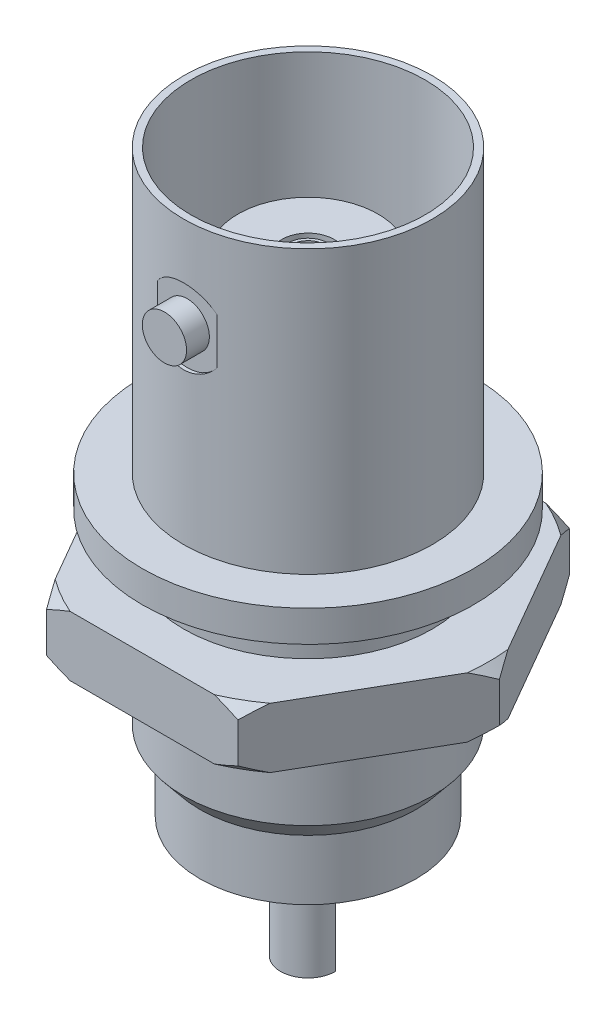
from build123d import *
from build123d.topology import SkipClean

# Parameters (mm, degrees)
BOSS_EXTRUDE1_START = 3.9
SKETCH2_R           = 4.7625
BOSS_EXTRUDE1_DEPTH = 2.3
BOSS_EXTRUDE2_START = 4.5
SKETCH5_R           = 0.846945363
BOSS_EXTRUDE2_DEPTH = 1
SKETCH6_R           = 0.645187132
CUT_EXTRUDE1_DEPTH  = 5
SKETCH9_W           = 0.137399245
SKETCH9_H           = 0.594121804
BOSS_EXTRUDE3_START = 3
BOSS_EXTRUDE3_DEPTH = 3
SKETCH11_R          = 0.94402027
CUT_EXTRUDE2_DEPTH  = 3
SKETCH13_R          = 0.99938664
SKETCH13_R_2        = 0.759397748
CUT_EXTRUDE4_DEPTH  = 4


with BuildPart() as part:
    # Sketch1 → Revolve1 (revolve)
    with BuildSketch(Plane.XY, mode=Mode.PRIVATE) as revolve1_sk:
        Polygon((0, 7.249356935), (-2.68096621, 7.249356935), (-2.68096621, 0), (-4.484856827, 0), (-4.484856827, 10.8), (-4.7625, 10.8), (-4.7625, 0), (-6.35, 0), (-6.35, -1.2), (-4.7625, -1.2), (-4.7625, -8.33684753), (-4.138651138, -9.1), (-4.138651138, -11.4), (-1.05, -11.4), (-1.05, -13.015612484), (0, -13.015612484), align=None)
    revolve(revolve1_sk.sketch.rotate(Axis((0, 72.402332312, 0), (0, -1, 0)), 270), axis=Axis((0, 72.402332312, 0), (0, -1, 0)))

    # Sketch2 → Boss-Extrude1 (add)
    with BuildSketch(Plane.XZ.offset(1.2).offset(BOSS_EXTRUDE1_START)):
        Polygon((3.666174209, -6.35), (7.332348419, 0), (3.666174209, 6.35), (-3.666174209, 6.35), (-7.332348419, 0), (-3.666174209, -6.35), align=None)
        with Locations(Location((0, 0, 0), (0, 0, 90))):
            Circle(SKETCH2_R, mode=Mode.SUBTRACT)
    extrude(amount=-BOSS_EXTRUDE1_DEPTH)

    # Sketch4 → Cut-Revolve1 (revolve, cut)
    with BuildSketch(Plane.XY):
        Polygon((-6.925646916, -2.8), (-7.332348419, -3.186501065), (-8.999279983, -3.186501065), (-8.361056601, -0.327260314), (-6.925646916, 0.349979738), align=None)
        Polygon((-6.925646916, -8.249979738), (-6.925646916, -5.1), (-7.332348419, -4.713498935), (-8.999279983, -4.713498935), (-8.361056601, -7.572739686), align=None)
    revolve(axis=Axis((0, 10.8, 0), (0, -1, 0)), mode=Mode.SUBTRACT)

    # Sketch5 → Boss-Extrude2 (add)
    with BuildSketch(Plane.XY.offset(BOSS_EXTRUDE2_START)):
        with Locations(Location((0, 7.245112304, 0), (0, 0, 270))):
            Circle(SKETCH5_R)
    boss_extrude2 = extrude(amount=BOSS_EXTRUDE2_DEPTH)

    # Mirror1: Boss-Extrude2 across plane
    add(boss_extrude2.mirror(Plane.XY))

    # Sketch6 → Cut-Extrude1 (cut)
    with BuildSketch(Plane(origin=(0, 7.249356935, 0), x_dir=(1, 0, 0), z_dir=(0, 1, 0))):
        with Locations(Location((0, 0, 0), (0, 0, 270))):
            Circle(SKETCH6_R)
    extrude(amount=-CUT_EXTRUDE1_DEPTH, mode=Mode.SUBTRACT)

    # Sketch9 → Cut-Revolve2 (revolve, cut)
    with SkipClean():  # the faces are left unmerged after this step: merging them gives an invalid solid
        with BuildSketch(Plane(origin=(0, 0, 0), x_dir=(0, 0, -1), z_dir=(1, 0, 0)), mode=Mode.PRIVATE) as cut_revolve2_sk:
            with Locations((4.693800378, 8.389118569)):
                Rectangle(SKETCH9_W, SKETCH9_H)
            with Locations((-4.693800378, 8.389118569)):
                Rectangle(SKETCH9_W, SKETCH9_H)
        revolve(cut_revolve2_sk.sketch.rotate(Axis((0, 7.245112304, 5.5), (0, 0, -1)), 90), axis=Axis((0, 7.245112304, 5.5), (0, 0, -1)), mode=Mode.SUBTRACT)

    # Sketch10 → Boss-Extrude3 (add)
    with SkipClean():  # the faces are left unmerged after this step: merging them gives an invalid solid
        with BuildSketch(Plane.XZ.offset(13.015612484).offset(BOSS_EXTRUDE3_START)):
            with BuildLine():
                Line((0.94402027, 0), (1.05, 0))
                ThreePointArc((1.05, 0), (0, 1.05), (-1.05, 0))
                Line((-1.05, 0), (-0.94402027, 0))
                ThreePointArc((-0.94402027, 0), (0, 0.94402027), (0.94402027, 0))
            make_face()
        extrude(amount=-BOSS_EXTRUDE3_DEPTH)

    # Sketch11 → Cut-Extrude2 (cut)
    with SkipClean():  # the faces are left unmerged after this step: merging them gives an invalid solid
        with BuildSketch(Plane.XZ.offset(13.015612484)):
            Circle(SKETCH11_R)
        extrude(amount=-CUT_EXTRUDE2_DEPTH, mode=Mode.SUBTRACT)

    # Sketch13 → Cut-Extrude4 (cut)
    with SkipClean():  # the faces are left unmerged after this step: merging them gives an invalid solid
        with BuildSketch(Plane(origin=(0, 7.249356935, 0), x_dir=(1, 0, 0), z_dir=(0, 1, 0))):
            with Locations(Location((0, 0, 0), (0, 0, 270))):
                Circle(SKETCH13_R)
            with Locations(Location((0, 0, 0), (0, 0, 270))):
                Circle(SKETCH13_R_2, mode=Mode.SUBTRACT)
        extrude(amount=-CUT_EXTRUDE4_DEPTH, mode=Mode.SUBTRACT)


solid = part.part
